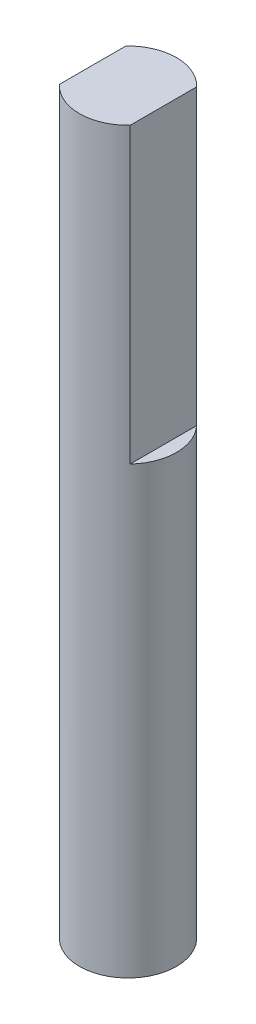
from build123d import *

# Parameters (mm, degrees)
CROQUIS2_R                   = 2.4
SALIENTE_EXTRUIR1_DEPTH      = 18.25
CORTAR_EXTRUIR_L_MINA1_DEPTH = 14.5


with BuildPart() as part:
    # Croquis2 → Saliente-Extruir1 (new, symmetric)
    with BuildSketch(Plane(origin=(0, 0, 0), x_dir=(1, 0, 0), z_dir=(0, 1, 0))):
        with Locations(Location((0, 0, 0), (0, 0, 270))):
            Circle(CROQUIS2_R)
    extrude(amount=SALIENTE_EXTRUIR1_DEPTH, both=True)

    # Croquis3 → Cortar-Extruir-Lámina1 (cut)
    with BuildSketch(Plane(origin=(0, 18.25, 0), x_dir=(1, 0, 0), z_dir=(0, 1, 0))):
        with BuildLine():
            Line((-11.75, 3.962007067), (-11.75, -3.962007067))
            ThreePointArc((-11.75, -3.962007067), (0, -12.4), (11.75, -3.962007067))
            Line((11.75, -3.962007067), (11.75, 3.962007067))
            ThreePointArc((11.75, 3.962007067), (0, 12.4), (-11.75, 3.962007067))
        make_face()
        with BuildLine():
            Line((-1.75, 1.642406771), (-1.75, -1.642406771))
            ThreePointArc((-1.75, -1.642406771), (0, -2.4), (1.75, -1.642406771))
            Line((1.75, -1.642406771), (1.75, 1.642406771))
            ThreePointArc((1.75, 1.642406771), (0, 2.4), (-1.75, 1.642406771))
        make_face(mode=Mode.SUBTRACT)
    extrude(amount=-CORTAR_EXTRUIR_L_MINA1_DEPTH, mode=Mode.SUBTRACT)


solid = part.part
